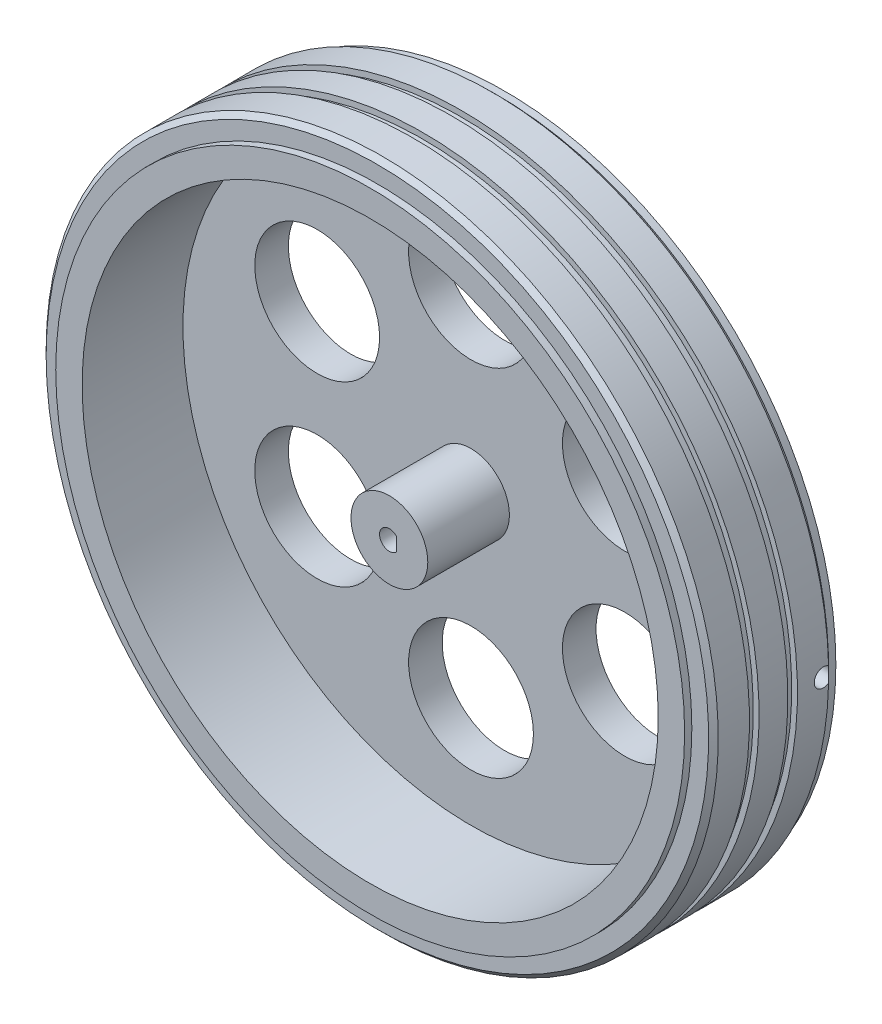
from build123d import *

# Parameters (mm, degrees)
SKETCH1_R              = 64
SKETCH1_R_2            = 60
RIM_DEPTH              = 28
SKETCH2_R              = 65.5
SKETCH2_R_2            = 63
INNER_BEAD_LIP_DEPTH   = 1.5
SKETCH3_R              = 65.5
SKETCH3_R_2            = 63
OUTER_BEAD_LIP_DEPTH   = 1.5
SKETCH4_R              = 61
WEB_DEPTH              = 7
SKETCH5_R              = 8
HUB_BOSS_DEPTH         = 24
SKETCH6_R              = 13
LIGHTENING_HOLES_DEPTH = 9
D_BORE_4MM_DEPTH       = 30
SKETCH9_R              = 69
SKETCH9_R_2            = 64
BED_RING_DEPTH         = 1.5
SKETCH10_R             = 1.3
GRUB_SCREW_M3_DEPTH    = 9
SKETCH11_R             = 1.9
GRUB_KEY_ACCESS_DEPTH  = 62.5


with BuildPart() as part:
    # Sketch1 → Rim (new body)
    with BuildSketch(Plane.XY):
        Circle(SKETCH1_R)
        Circle(SKETCH1_R_2, mode=Mode.SUBTRACT)
    extrude(amount=RIM_DEPTH)

    # Sketch2 → Inner_bead_lip (add)
    with BuildSketch(Plane.XY):
        Circle(SKETCH2_R)
        Circle(SKETCH2_R_2, mode=Mode.SUBTRACT)
    extrude(amount=INNER_BEAD_LIP_DEPTH)

    # Sketch3 → Outer_bead_lip (add)
    with BuildSketch(Plane.XY.offset(26.5)):
        Circle(SKETCH3_R)
        Circle(SKETCH3_R_2, mode=Mode.SUBTRACT)
    extrude(amount=OUTER_BEAD_LIP_DEPTH)

    # Sketch4 → Web (add)
    with BuildSketch(Plane.XY):
        Circle(SKETCH4_R)
    extrude(amount=WEB_DEPTH)

    # Sketch5 → Hub_boss (add)
    with BuildSketch(Plane.XY):
        Circle(SKETCH5_R)
    extrude(amount=HUB_BOSS_DEPTH)

    # Sketch6 → Lightening_holes (cut)
    with BuildSketch(Plane.XY.offset(-1)):
        with Locations((32.04293994, 18.5)):
            Circle(SKETCH6_R)
        with Locations((0, 37)):
            Circle(SKETCH6_R)
        with Locations((-32.04293994, 18.5)):
            Circle(SKETCH6_R)
        with Locations((-32.04293994, -18.5)):
            Circle(SKETCH6_R)
        with Locations((0, -37)):
            Circle(SKETCH6_R)
        with Locations((32.04293994, -18.5)):
            Circle(SKETCH6_R)
    extrude(amount=LIGHTENING_HOLES_DEPTH, mode=Mode.SUBTRACT)

    # Sketch7 → D_bore_4mm (cut)
    with BuildSketch(Plane.XY.offset(-1)):
        with BuildLine():
            Line((1.5, -1.397318861), (1.5, 1.397318861))
            ThreePointArc((1.5, 1.397318861), (-2.05, 0), (1.5, -1.397318861))
        make_face()
    extrude(amount=D_BORE_4MM_DEPTH, mode=Mode.SUBTRACT)

    # Sketch8 → Tyre (revolve)
    with BuildSketch(Plane(origin=(0, 0, 0), x_dir=(0, 0, -1), z_dir=(1, 0, 0)), mode=Mode.PRIVATE) as tyre_sk:
        Polygon((-1.5, 64), (-26.5, 64), (-26.5, 69), (-25.5, 70), (-19, 70), (-19, 68.8), (-17, 68.8), (-17, 70), (-11, 70), (-11, 68.8), (-9, 68.8), (-9, 70), (-2.5, 70), (-1.5, 69), align=None)
    revolve(tyre_sk.sketch.rotate(Axis((0, 0, 0), (0, 0, 1)), 90), axis=Axis((0, 0, 0), (0, 0, 1)))

    # Sketch9 → Bed_ring (add)
    with BuildSketch(Plane.XY):
        with Locations(Location((0, 0, 0), (0, 0, 180))):
            Circle(SKETCH9_R)
        Circle(SKETCH9_R_2, mode=Mode.SUBTRACT)
    extrude(amount=BED_RING_DEPTH)

    # Sketch10 → Grub_screw_M3 (cut)
    with BuildSketch(Plane(origin=(0, 0, 0), x_dir=(0, 0, -1), z_dir=(1, 0, 0))):
        with Locations(Location((-3.6, 0, 0), (0, 0, 270))):
            Circle(SKETCH10_R)
    extrude(amount=GRUB_SCREW_M3_DEPTH, mode=Mode.SUBTRACT)

    # Sketch11 → Grub_key_access (cut)
    with BuildSketch(Plane(origin=(8.5, 0, 0), x_dir=(0, 0, -1), z_dir=(1, 0, 0))):
        with Locations(Location((-3.6, 0, 0), (0, 0, 54.623459848))):
            Circle(SKETCH11_R)
    extrude(amount=GRUB_KEY_ACCESS_DEPTH, mode=Mode.SUBTRACT)


solid = part.part
